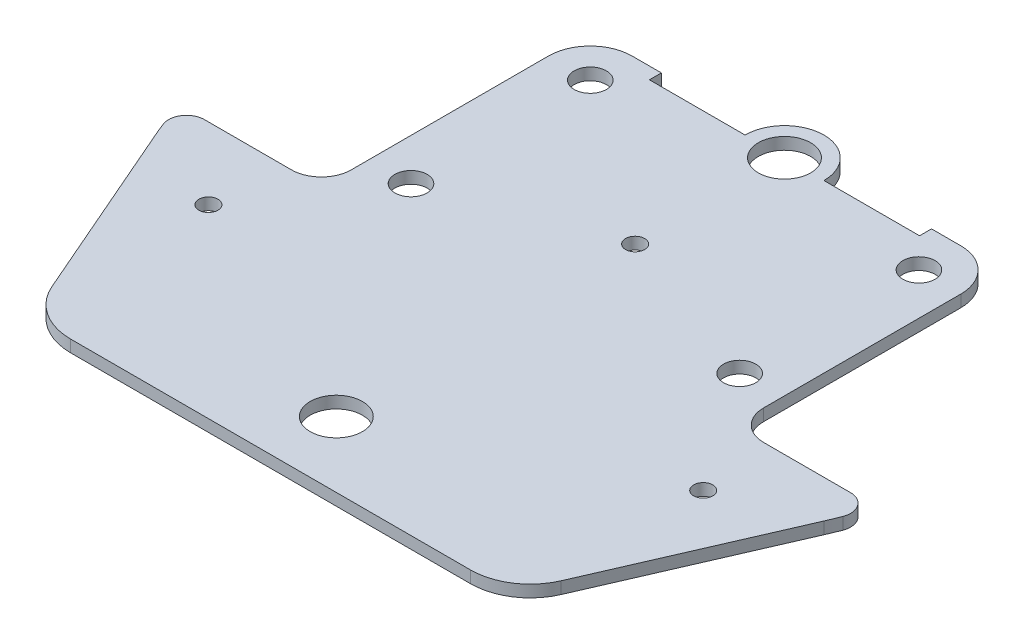
from build123d import *

# Parameters (mm, degrees)
SKETCH1_R           = 2.7
BOSS_EXTRUDE1_DEPTH = 2
BOSS_EXTRUDE2_START = -2
BOSS_EXTRUDE2_DEPTH = 2
FILLET1_R           = 3
SKETCH2_R           = 4.375
SKETCH2_R_2         = 1.6
CUT_EXTRUDE1_DEPTH  = 84.55470457
FILLET2_R           = 10


with BuildPart() as part:
    # Sketch1 → Boss-Extrude1 (new body)
    # profile 1 of 9: a face of its own
    with BuildSketch(Plane(origin=(0, 0, 0), x_dir=(1, 0, 0), z_dir=(0, 1, 0))):
        with BuildLine():
            Line((-34.5, 20), (-34.5, -10))
            ThreePointArc((-34.5, -10), (-27.5, -17), (-20.5, -10))
            Line((-20.5, -10), (-20.5, 20))
            ThreePointArc((-20.5, 20), (-27.5, 27), (-34.5, 20))
        make_face()
        with Locations(Location((-27.5, 20, 0), (0, 0, 270))):
            Circle(SKETCH1_R, mode=Mode.SUBTRACT)
        with Locations(Location((-27.5, -10, 0), (0, 0, 270))):
            Circle(SKETCH1_R, mode=Mode.SUBTRACT)
    # profile 2 of 9: a face of its own
    with BuildSketch(Plane(origin=(0, 0, 0), x_dir=(1, 0, 0), z_dir=(0, 1, 0))):
        with BuildLine():
            ThreePointArc((-22.601020514, 25), (-21.046595612, 22.711747002), (-20.5, 20))
            Line((-20.5, 20), (-20.5, -10))
            ThreePointArc((-20.5, -10), (-27.5, -17), (-34.5, -10))
            Line((-34.5, -10), (-34.5, -50.306560208))
            ThreePointArc((-34.5, -50.306560208), (0, -61), (34.5, -50.306560208))
            Line((34.5, -50.306560208), (34.5, -10))
            ThreePointArc((34.5, -10), (27.5, -17), (20.5, -10))
            Line((20.5, -10), (20.5, 20))
            ThreePointArc((20.5, 20), (21.046595612, 22.711747002), (22.601020514, 25))
            Line((22.601020514, 25), (6.601020514, 25))
            ThreePointArc((6.601020514, 25), (0, 18.398979486), (-6.601020514, 25))
            Line((-6.601020514, 25), (-22.601020514, 25))
        make_face()
    # profile 3 of 9: a face of its own
    with BuildSketch(Plane(origin=(0, 0, 0), x_dir=(1, 0, 0), z_dir=(0, 1, 0))):
        with BuildLine():
            ThreePointArc((34.5, -10), (27.5, -17), (20.5, -10))
            Line((20.5, -10), (20.5, 20))
            ThreePointArc((20.5, 20), (27.5, 27), (34.5, 20))
            Line((34.5, 20), (34.5, -10))
        make_face()
        with Locations(Location((27.5, -10, 0), (0, 0, 270))):
            Circle(SKETCH1_R, mode=Mode.SUBTRACT)
        with Locations(Location((27.5, 20, 0), (0, 0, 270))):
            Circle(SKETCH1_R, mode=Mode.SUBTRACT)
    # profile 4 of 9: a face of its own
    with BuildSketch(Plane(origin=(0, 0, 0), x_dir=(1, 0, 0), z_dir=(0, 1, 0))):
        with BuildLine():
            ThreePointArc((-6.290744935, 27), (-6.522990426, 26.011962318), (-6.601020514, 25))
            ThreePointArc((-6.601020514, 25), (0, 18.398979486), (6.601020514, 25))
            ThreePointArc((6.601020514, 25), (6.522990426, 26.011962318), (6.290744935, 27))
            Line((6.290744935, 27), (-6.290744935, 27))
        make_face()
    # profile 5 of 9: a face of its own
    with BuildSketch(Plane(origin=(0, 0, 0), x_dir=(1, 0, 0), z_dir=(0, 1, 0))):
        with BuildLine():
            ThreePointArc((6.290744935, 27), (0, 31.601020514), (-6.290744935, 27))
            Line((-6.290744935, 27), (6.290744935, 27))
        make_face()
    # profile 6 of 9: a face of its own
    with BuildSketch(Plane(origin=(0, 0, 0), x_dir=(1, 0, 0), z_dir=(0, 1, 0))):
        with BuildLine():
            ThreePointArc((-6.290744935, 27), (-6.522990426, 26.011962318), (-6.601020514, 25))
            ThreePointArc((-6.601020514, 25), (0, 18.398979486), (6.601020514, 25))
            ThreePointArc((6.601020514, 25), (6.522990426, 26.011962318), (6.290744935, 27))
            Line((6.290744935, 27), (-6.290744935, 27))
        make_face()
    # profile 7 of 9: a face of its own
    with BuildSketch(Plane(origin=(0, 0, 0), x_dir=(1, 0, 0), z_dir=(0, 1, 0))):
        with BuildLine():
            ThreePointArc((6.290744935, 27), (0, 31.601020514), (-6.290744935, 27))
            Line((-6.290744935, 27), (6.290744935, 27))
        make_face()
    # profile 8 of 9: a face of its own
    with BuildSketch(Plane(origin=(0, 0, 0), x_dir=(1, 0, 0), z_dir=(0, 1, 0))):
        with BuildLine():
            ThreePointArc((-27.5, 27), (-24.854248689, 26.480740698), (-22.601020514, 25))
            Line((-22.601020514, 25), (-22.601020514, 27))
            Line((-22.601020514, 27), (-27.5, 27))
        make_face()
    # profile 9 of 9: a face of its own
    with BuildSketch(Plane(origin=(0, 0, 0), x_dir=(1, 0, 0), z_dir=(0, 1, 0))):
        with BuildLine():
            Line((22.601020514, 27), (22.601020514, 25))
            ThreePointArc((22.601020514, 25), (24.854248689, 26.480740698), (27.5, 27))
            Line((27.5, 27), (22.601020514, 27))
        make_face()
    extrude(amount=BOSS_EXTRUDE1_DEPTH)

    # Sketch5 → Boss-Extrude2 (add)
    with BuildSketch(Plane(origin=(0, 2, 0), x_dir=(1, 0, 0), z_dir=(0, 1, 0)).offset(BOSS_EXTRUDE2_START)):
        with BuildLine():
            Line((-55.944371359, -24.315166322), (-40, -61))
            Line((-40, -61), (0, -61))
            ThreePointArc((0, -61), (-18.059621083, -58.265342068), (-34.5, -50.306560208))
            Line((-34.5, -50.306560208), (-34.5, -13))
            ThreePointArc((-34.5, -13), (-35.964466094, -16.535533906), (-39.5, -18))
            Line((-39.5, -18), (-58.283788484, -18))
            ThreePointArc((-58.283788484, -18), (-57.201297683, -21.189892481), (-55.944371359, -24.315166322))
        make_face()
        with BuildLine():
            ThreePointArc((34.5, -50.306560208), (18.059621083, -58.265342068), (0, -61))
            Line((0, -61), (40, -61))
            Line((40, -61), (55.944371359, -24.315166322))
            ThreePointArc((55.944371359, -24.315166322), (57.201297683, -21.189892481), (58.283788484, -18))
            Line((58.283788484, -18), (39.5, -18))
            ThreePointArc((39.5, -18), (35.964466094, -16.535533906), (34.5, -13))
            Line((34.5, -13), (34.5, -50.306560208))
        make_face()
    extrude(amount=BOSS_EXTRUDE2_DEPTH)

    # Fillet1
    fillet1_edges = [part.edges().sort_by_distance(p)[0] for p in [
        (-58.283788484, 1, 18),
        (58.283788484, 1, 18),
    ]]
    fillet(fillet1_edges, radius=FILLET1_R)

    # Sketch2 → Cut-Extrude1 (cut, through all)
    with BuildSketch(Plane(origin=(0, 2, 0), x_dir=(1, 0, 0), z_dir=(0, 1, 0))):
        with Locations(Location((0, 25, 0), (0, 0, 270))):
            Circle(SKETCH2_R)
        with Locations(Location((0, -50, 0), (0, 0, 270))):
            Circle(SKETCH2_R)
        with Locations(Location((0, 0, 0), (0, 0, 270))):
            Circle(SKETCH2_R_2)
        with Locations(Location((-41.4, -30, 0), (0, 0, 270))):
            Circle(SKETCH2_R_2)
        with Locations(Location((41.4, -30, 0), (0, 0, 90))):
            Circle(SKETCH2_R_2)
    extrude(amount=-CUT_EXTRUDE1_DEPTH, mode=Mode.SUBTRACT)

    # Fillet2
    fillet2_edges = [part.edges().sort_by_distance(p)[0] for p in [
        (-40, 1, 61),
        (40, 1, 61),
    ]]
    fillet(fillet2_edges, radius=FILLET2_R)


solid = part.part
